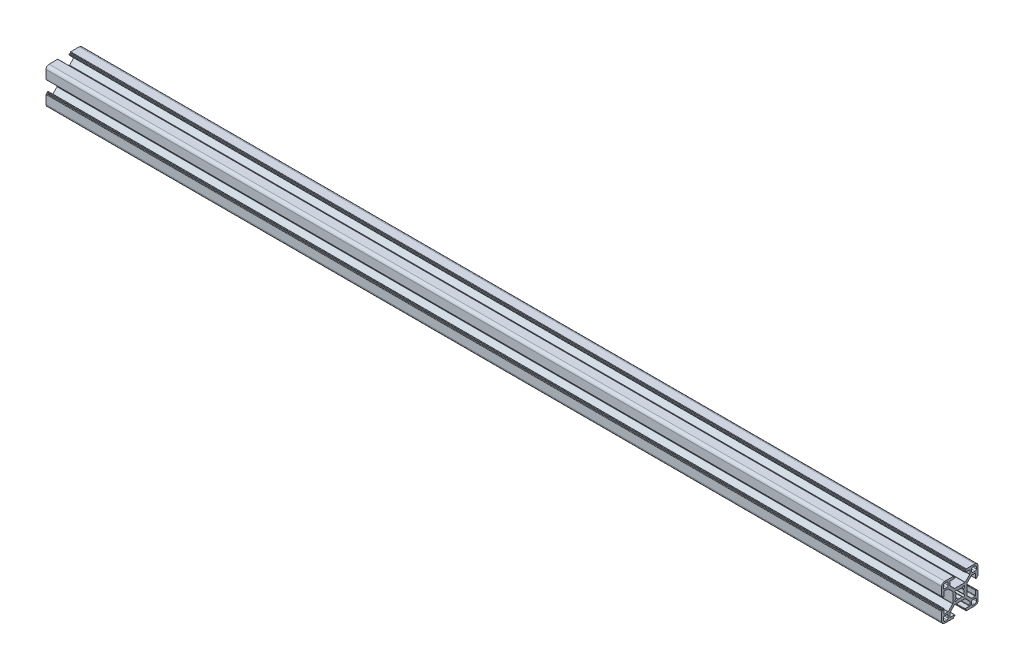
from build123d import *

# Parameters (mm, degrees)
BOSS_EXTRUDE1_DEPTH = 740


with BuildPart() as part:
    # Sketch1 → Boss-Extrude1 (new body)
    with BuildSketch(Plane(origin=(0, 0, 0), x_dir=(0, 0, -1), z_dir=(1, 0, 0))):
        with BuildLine():
            Line((-8.25, 9.788477631), (-8.25, 12.7))
            ThreePointArc((-8.25, 12.7), (-8.162132034, 12.912132034), (-7.95, 13))
            Line((-7.95, 13), (-4.4, 13))
            ThreePointArc((-4.4, 13), (-4.187867966, 13.087867966), (-4.1, 13.3))
            Line((-4.1, 13.3), (-4.1, 13.7))
            ThreePointArc((-4.1, 13.7), (-4.187867966, 13.912132034), (-4.4, 14))
            Line((-4.4, 14), (-4.8, 14))
            ThreePointArc((-4.8, 14), (-5.012132034, 14.087867966), (-5.1, 14.3))
            Line((-5.1, 14.3), (-5.1, 14.7))
            ThreePointArc((-5.1, 14.7), (-5.187867966, 14.912132034), (-5.4, 15))
            Line((-5.4, 15), (-12.5, 15))
            ThreePointArc((-12.5, 15), (-14.267766953, 14.267766953), (-15, 12.5))
            Line((-15, 12.5), (-15, 5.4))
            ThreePointArc((-15, 5.4), (-14.912132034, 5.187867966), (-14.7, 5.1))
            Line((-14.7, 5.1), (-14.3, 5.1))
            ThreePointArc((-14.3, 5.1), (-14.087867966, 5.012132034), (-14, 4.8))
            Line((-14, 4.8), (-14, 4.4))
            ThreePointArc((-14, 4.4), (-13.912132034, 4.187867966), (-13.7, 4.1))
            Line((-13.7, 4.1), (-13.3, 4.1))
            ThreePointArc((-13.3, 4.1), (-13.087867966, 4.187867966), (-13, 4.4))
            Line((-13, 4.4), (-13, 7.95))
            ThreePointArc((-13, 7.95), (-12.912132034, 8.162132034), (-12.7, 8.25))
            Line((-12.7, 8.25), (-9.788477631, 8.25))
            ThreePointArc((-9.788477631, 8.25), (-9.673672601, 8.22716386), (-9.576345597, 8.162132034))
            Line((-9.576345597, 8.162132034), (-5.887867966, 4.473654403))
            ThreePointArc((-5.887867966, 4.473654403), (-5.82283614, 4.376327399), (-5.8, 4.261522369))
            Line((-5.8, 4.261522369), (-5.8, -4.261522369))
            ThreePointArc((-5.8, -4.261522369), (-5.82283614, -4.376327399), (-5.887867966, -4.473654403))
            Line((-5.887867966, -4.473654403), (-9.576345597, -8.162132034))
            ThreePointArc((-9.576345597, -8.162132034), (-9.673672601, -8.22716386), (-9.788477631, -8.25))
            Line((-9.788477631, -8.25), (-12.7, -8.25))
            ThreePointArc((-12.7, -8.25), (-12.912132034, -8.162132034), (-13, -7.95))
            Line((-13, -7.95), (-13, -4.4))
            ThreePointArc((-13, -4.4), (-13.087867966, -4.187867966), (-13.3, -4.1))
            Line((-13.3, -4.1), (-13.7, -4.1))
            ThreePointArc((-13.7, -4.1), (-13.912132034, -4.187867966), (-14, -4.4))
            Line((-14, -4.4), (-14, -4.8))
            ThreePointArc((-14, -4.8), (-14.087867966, -5.012132034), (-14.3, -5.1))
            Line((-14.3, -5.1), (-14.7, -5.1))
            ThreePointArc((-14.7, -5.1), (-14.912132034, -5.187867966), (-15, -5.4))
            Line((-15, -5.4), (-15, -12.5))
            ThreePointArc((-15, -12.5), (-14.267766953, -14.267766953), (-12.5, -15))
            Line((-12.5, -15), (-5.4, -15))
            ThreePointArc((-5.4, -15), (-5.187867966, -14.912132034), (-5.1, -14.7))
            Line((-5.1, -14.7), (-5.1, -14.3))
            ThreePointArc((-5.1, -14.3), (-5.012132034, -14.087867966), (-4.8, -14))
            Line((-4.8, -14), (-4.4, -14))
            ThreePointArc((-4.4, -14), (-4.187867966, -13.912132034), (-4.1, -13.7))
            Line((-4.1, -13.7), (-4.1, -13.3))
            ThreePointArc((-4.1, -13.3), (-4.187867966, -13.087867966), (-4.4, -13))
            Line((-4.4, -13), (-7.95, -13))
            ThreePointArc((-7.95, -13), (-8.162132034, -12.912132034), (-8.25, -12.7))
            Line((-8.25, -12.7), (-8.25, -9.788477631))
            ThreePointArc((-8.25, -9.788477631), (-8.22716386, -9.673672601), (-8.162132034, -9.576345597))
            Line((-8.162132034, -9.576345597), (-4.473654403, -5.887867966))
            ThreePointArc((-4.473654403, -5.887867966), (-4.376327399, -5.82283614), (-4.261522369, -5.8))
            Line((-4.261522369, -5.8), (4.261522369, -5.8))
            ThreePointArc((4.261522369, -5.8), (4.376327399, -5.82283614), (4.473654403, -5.887867966))
            Line((4.473654403, -5.887867966), (8.162132034, -9.576345597))
            ThreePointArc((8.162132034, -9.576345597), (8.22716386, -9.673672601), (8.25, -9.788477631))
            Line((8.25, -9.788477631), (8.25, -12.7))
            ThreePointArc((8.25, -12.7), (8.162132034, -12.912132034), (7.95, -13))
            Line((7.95, -13), (4.4, -13))
            ThreePointArc((4.4, -13), (4.187867966, -13.087867966), (4.1, -13.3))
            Line((4.1, -13.3), (4.1, -13.7))
            ThreePointArc((4.1, -13.7), (4.187867966, -13.912132034), (4.4, -14))
            Line((4.4, -14), (4.8, -14))
            ThreePointArc((4.8, -14), (5.012132034, -14.087867966), (5.1, -14.3))
            Line((5.1, -14.3), (5.1, -14.7))
            ThreePointArc((5.1, -14.7), (5.187867966, -14.912132034), (5.4, -15))
            Line((5.4, -15), (12.5, -15))
            ThreePointArc((12.5, -15), (14.267766953, -14.267766953), (15, -12.5))
            Line((15, -12.5), (15, -5.4))
            ThreePointArc((15, -5.4), (14.912132034, -5.187867966), (14.7, -5.1))
            Line((14.7, -5.1), (14.3, -5.1))
            ThreePointArc((14.3, -5.1), (14.087867966, -5.012132034), (14, -4.8))
            Line((14, -4.8), (14, -4.4))
            ThreePointArc((14, -4.4), (13.912132034, -4.187867966), (13.7, -4.1))
            Line((13.7, -4.1), (13.3, -4.1))
            ThreePointArc((13.3, -4.1), (13.087867966, -4.187867966), (13, -4.4))
            Line((13, -4.4), (13, -7.95))
            ThreePointArc((13, -7.95), (12.912132034, -8.162132034), (12.7, -8.25))
            Line((12.7, -8.25), (9.788477631, -8.25))
            ThreePointArc((9.788477631, -8.25), (9.673672601, -8.22716386), (9.576345597, -8.162132034))
            Line((9.576345597, -8.162132034), (5.887867966, -4.473654403))
            ThreePointArc((5.887867966, -4.473654403), (5.82283614, -4.376327399), (5.8, -4.261522369))
            Line((5.8, -4.261522369), (5.8, 4.261522369))
            ThreePointArc((5.8, 4.261522369), (5.82283614, 4.376327399), (5.887867966, 4.473654403))
            Line((5.887867966, 4.473654403), (9.576345597, 8.162132034))
            ThreePointArc((9.576345597, 8.162132034), (9.673672601, 8.22716386), (9.788477631, 8.25))
            Line((9.788477631, 8.25), (12.7, 8.25))
            ThreePointArc((12.7, 8.25), (12.912132034, 8.162132034), (13, 7.95))
            Line((13, 7.95), (13, 4.4))
            ThreePointArc((13, 4.4), (13.087867966, 4.187867966), (13.3, 4.1))
            Line((13.3, 4.1), (13.7, 4.1))
            ThreePointArc((13.7, 4.1), (13.912132034, 4.187867966), (14, 4.4))
            Line((14, 4.4), (14, 4.8))
            ThreePointArc((14, 4.8), (14.087867966, 5.012132034), (14.3, 5.1))
            Line((14.3, 5.1), (14.7, 5.1))
            ThreePointArc((14.7, 5.1), (14.912132034, 5.187867966), (15, 5.4))
            Line((15, 5.4), (15, 12.5))
            ThreePointArc((15, 12.5), (14.267766953, 14.267766953), (12.5, 15))
            Line((12.5, 15), (5.4, 15))
            ThreePointArc((5.4, 15), (5.187867966, 14.912132034), (5.1, 14.7))
            Line((5.1, 14.7), (5.1, 14.3))
            ThreePointArc((5.1, 14.3), (5.012132034, 14.087867966), (4.8, 14))
            Line((4.8, 14), (4.4, 14))
            ThreePointArc((4.4, 14), (4.187867966, 13.912132034), (4.1, 13.7))
            Line((4.1, 13.7), (4.1, 13.3))
            ThreePointArc((4.1, 13.3), (4.187867966, 13.087867966), (4.4, 13))
            Line((4.4, 13), (7.95, 13))
            ThreePointArc((7.95, 13), (8.162132034, 12.912132034), (8.25, 12.7))
            Line((8.25, 12.7), (8.25, 9.788477631))
            ThreePointArc((8.25, 9.788477631), (8.22716386, 9.673672601), (8.162132034, 9.576345597))
            Line((8.162132034, 9.576345597), (4.473654403, 5.887867966))
            ThreePointArc((4.473654403, 5.887867966), (4.376327399, 5.82283614), (4.261522369, 5.8))
            Line((4.261522369, 5.8), (-4.261522369, 5.8))
            ThreePointArc((-4.261522369, 5.8), (-4.376327399, 5.82283614), (-4.473654403, 5.887867966))
            Line((-4.473654403, 5.887867966), (-8.162132034, 9.576345597))
            ThreePointArc((-8.162132034, 9.576345597), (-8.22716386, 9.673672601), (-8.25, 9.788477631))
        make_face()
        with BuildLine():
            Line((3.05514787, -1.904659815), (3.741964502, -2.698343541))
            ThreePointArc((3.741964502, -2.698343541), (3.70396732, -3.720635173), (2.68151539, -3.75404201))
            Line((2.68151539, -3.75404201), (1.890923385, -3.06366876))
            ThreePointArc((1.890923385, -3.06366876), (1.729867527, -2.991839768), (1.556279141, -3.022911715))
            ThreePointArc((1.556279141, -3.022911715), (0, -3.4), (-1.55627914, -3.022911715))
            ThreePointArc((-1.55627914, -3.022911715), (-1.729867526, -2.991839768), (-1.890923385, -3.06366876))
            Line((-1.890923385, -3.06366876), (-2.68151539, -3.75404201))
            ThreePointArc((-2.68151539, -3.75404201), (-3.70396732, -3.720635173), (-3.741964502, -2.698343541))
            Line((-3.741964502, -2.698343541), (-3.05514787, -1.904659815))
            ThreePointArc((-3.05514787, -1.904659815), (-2.984042722, -1.743283077), (-3.015893746, -1.56983595))
            ThreePointArc((-3.015893746, -1.56983595), (-3.4, 0), (-3.015893746, 1.56983595))
            ThreePointArc((-3.015893746, 1.56983595), (-2.984042722, 1.743283077), (-3.05514787, 1.904659815))
            Line((-3.05514787, 1.904659815), (-3.741964502, 2.698343541))
            ThreePointArc((-3.741964502, 2.698343541), (-3.70396732, 3.720635173), (-2.68151539, 3.75404201))
            Line((-2.68151539, 3.75404201), (-1.890923385, 3.06366876))
            ThreePointArc((-1.890923385, 3.06366876), (-1.729867526, 2.991839768), (-1.55627914, 3.022911715))
            ThreePointArc((-1.55627914, 3.022911715), (0, 3.4), (1.556279141, 3.022911715))
            ThreePointArc((1.556279141, 3.022911715), (1.729867527, 2.991839768), (1.890923385, 3.06366876))
            Line((1.890923385, 3.06366876), (2.68151539, 3.75404201))
            ThreePointArc((2.68151539, 3.75404201), (3.70396732, 3.720635173), (3.741964502, 2.698343541))
            Line((3.741964502, 2.698343541), (3.05514787, 1.904659815))
            ThreePointArc((3.05514787, 1.904659815), (2.984042722, 1.743283077), (3.015893747, 1.56983595))
            ThreePointArc((3.015893747, 1.56983595), (3.4, 0), (3.015893747, -1.56983595))
            ThreePointArc((3.015893747, -1.56983595), (2.984042722, -1.743283077), (3.05514787, -1.904659815))
        make_face(mode=Mode.SUBTRACT)
        with BuildLine():
            Line((10.75, -9.75), (12.65, -9.75))
            ThreePointArc((12.65, -9.75), (13.357106781, -10.042893219), (13.65, -10.75))
            Line((13.65, -10.75), (13.65, -12.15))
            ThreePointArc((13.65, -12.15), (13.210660172, -13.210660172), (12.15, -13.65))
            Line((12.15, -13.65), (10.75, -13.65))
            ThreePointArc((10.75, -13.65), (10.042893219, -13.357106781), (9.75, -12.65))
            Line((9.75, -12.65), (9.75, -10.75))
            ThreePointArc((9.75, -10.75), (10.042893219, -10.042893219), (10.75, -9.75))
        make_face(mode=Mode.SUBTRACT)
        with BuildLine():
            Line((-10.75, 9.75), (-12.65, 9.75))
            ThreePointArc((-12.65, 9.75), (-13.357106781, 10.042893219), (-13.65, 10.75))
            Line((-13.65, 10.75), (-13.65, 12.15))
            ThreePointArc((-13.65, 12.15), (-13.210660172, 13.210660172), (-12.15, 13.65))
            Line((-12.15, 13.65), (-10.75, 13.65))
            ThreePointArc((-10.75, 13.65), (-10.042893219, 13.357106781), (-9.75, 12.65))
            Line((-9.75, 12.65), (-9.75, 10.75))
            ThreePointArc((-9.75, 10.75), (-10.042893219, 10.042893219), (-10.75, 9.75))
        make_face(mode=Mode.SUBTRACT)
        with BuildLine():
            Line((9.75, 10.75), (9.75, 12.65))
            ThreePointArc((9.75, 12.65), (10.042893219, 13.357106781), (10.75, 13.65))
            Line((10.75, 13.65), (12.15, 13.65))
            ThreePointArc((12.15, 13.65), (13.210660172, 13.210660172), (13.65, 12.15))
            Line((13.65, 12.15), (13.65, 10.75))
            ThreePointArc((13.65, 10.75), (13.357106781, 10.042893219), (12.65, 9.75))
            Line((12.65, 9.75), (10.75, 9.75))
            ThreePointArc((10.75, 9.75), (10.042893219, 10.042893219), (9.75, 10.75))
        make_face(mode=Mode.SUBTRACT)
        with BuildLine():
            Line((-9.75, -10.75), (-9.75, -12.65))
            ThreePointArc((-9.75, -12.65), (-10.042893219, -13.357106781), (-10.75, -13.65))
            Line((-10.75, -13.65), (-12.15, -13.65))
            ThreePointArc((-12.15, -13.65), (-13.210660172, -13.210660172), (-13.65, -12.15))
            Line((-13.65, -12.15), (-13.65, -10.75))
            ThreePointArc((-13.65, -10.75), (-13.357106781, -10.042893219), (-12.65, -9.75))
            Line((-12.65, -9.75), (-10.75, -9.75))
            ThreePointArc((-10.75, -9.75), (-10.042893219, -10.042893219), (-9.75, -10.75))
        make_face(mode=Mode.SUBTRACT)
    extrude(amount=BOSS_EXTRUDE1_DEPTH)


solid = part.part
